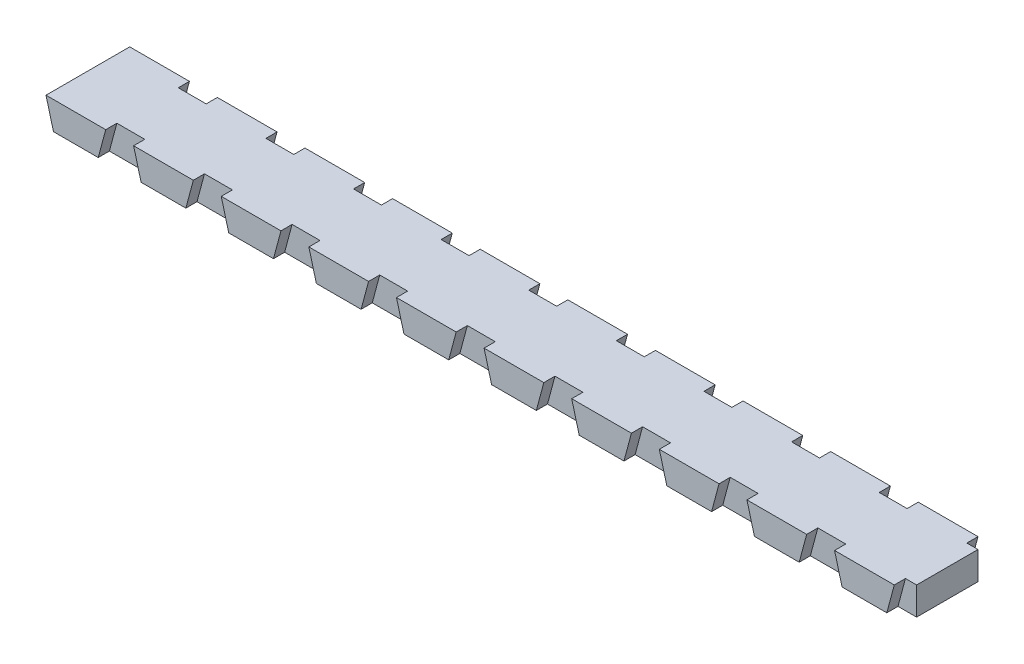
from build123d import *

# Parameters (mm, degrees)
SKETCH2_W            = 1540
SKETCH2_H            = 110
BOSS_EXTRUDE1_DEPTH  = 50
BOSS_EXTRUDE3_DEPTH  = 20
LPATTERN1_COUNT      = 10
LPATTERN1_PITCH      = 157
MIRROR2_COPY_1_DEPTH = 20
MIRROR2_COPY_2_DEPTH = 20
MIRROR2_COPY_3_DEPTH = 20
MIRROR2_COPY_4_DEPTH = 20
MIRROR2_COPY_5_DEPTH = 20
MIRROR2_COPY_6_DEPTH = 20
MIRROR2_COPY_7_DEPTH = 20
MIRROR2_COPY_8_DEPTH = 20
MIRROR2_COPY_9_DEPTH = 20


with BuildPart() as part:
    # Sketch2 → Boss-Extrude1 (new body)
    with BuildSketch(Plane(origin=(0, 0, 0), x_dir=(1, 0, 0), z_dir=(0, 1, 0))):
        Rectangle(SKETCH2_W, SKETCH2_H)
    extrude(amount=BOSS_EXTRUDE1_DEPTH)

    # Sketch4 → Boss-Extrude3 (add)
    with BuildSketch(Plane(origin=(0, 0, -55), x_dir=(-1, 0, 0), z_dir=(0, 0, -1))):
        Polygon((663, 50), (676.397459622, 0), (756.602540378, 0), (770, 50), align=None)
    boss_extrude3 = extrude(amount=BOSS_EXTRUDE3_DEPTH)

    # LPattern1: Boss-Extrude3 ×10
    with Locations(*[(i * LPATTERN1_PITCH, 0, 0) for i in range(1, LPATTERN1_COUNT)]):
        add(boss_extrude3)

    # Mirror2: Boss-Extrude3 across plane
    add(boss_extrude3.mirror(Plane(origin=(0, 0, 0), x_dir=(1, 0, 0), z_dir=(0, 0, -1))))

    # Mirror2 copy 1 sketch → Mirror2 copy 1 (add)
    with BuildSketch(Plane(origin=(157, 0, 55), x_dir=(-1, 0, 0), z_dir=(0, 0, 1))):
        Polygon((663, -50), (676.397459622, 0), (756.602540378, 0), (770, -50), align=None)
    extrude(amount=MIRROR2_COPY_1_DEPTH)

    # Mirror2 copy 2 sketch → Mirror2 copy 2 (add)
    with BuildSketch(Plane(origin=(314, 0, 55), x_dir=(-1, 0, 0), z_dir=(0, 0, 1))):
        Polygon((663, -50), (676.397459622, 0), (756.602540378, 0), (770, -50), align=None)
    extrude(amount=MIRROR2_COPY_2_DEPTH)

    # Mirror2 copy 3 sketch → Mirror2 copy 3 (add)
    with BuildSketch(Plane(origin=(471, 0, 55), x_dir=(-1, 0, 0), z_dir=(0, 0, 1))):
        Polygon((663, -50), (676.397459622, 0), (756.602540378, 0), (770, -50), align=None)
    extrude(amount=MIRROR2_COPY_3_DEPTH)

    # Mirror2 copy 4 sketch → Mirror2 copy 4 (add)
    with BuildSketch(Plane(origin=(628, 0, 55), x_dir=(-1, 0, 0), z_dir=(0, 0, 1))):
        Polygon((663, -50), (676.397459622, 0), (756.602540378, 0), (770, -50), align=None)
    extrude(amount=MIRROR2_COPY_4_DEPTH)

    # Mirror2 copy 5 sketch → Mirror2 copy 5 (add)
    with BuildSketch(Plane(origin=(785, 0, 55), x_dir=(-1, 0, 0), z_dir=(0, 0, 1))):
        Polygon((663, -50), (676.397459622, 0), (756.602540378, 0), (770, -50), align=None)
    extrude(amount=MIRROR2_COPY_5_DEPTH)

    # Mirror2 copy 6 sketch → Mirror2 copy 6 (add)
    with BuildSketch(Plane(origin=(942, 0, 55), x_dir=(-1, 0, 0), z_dir=(0, 0, 1))):
        Polygon((663, -50), (676.397459622, 0), (756.602540378, 0), (770, -50), align=None)
    extrude(amount=MIRROR2_COPY_6_DEPTH)

    # Mirror2 copy 7 sketch → Mirror2 copy 7 (add)
    with BuildSketch(Plane(origin=(1099, 0, 55), x_dir=(-1, 0, 0), z_dir=(0, 0, 1))):
        Polygon((663, -50), (676.397459622, 0), (756.602540378, 0), (770, -50), align=None)
    extrude(amount=MIRROR2_COPY_7_DEPTH)

    # Mirror2 copy 8 sketch → Mirror2 copy 8 (add)
    with BuildSketch(Plane(origin=(1256, 0, 55), x_dir=(-1, 0, 0), z_dir=(0, 0, 1))):
        Polygon((663, -50), (676.397459622, 0), (756.602540378, 0), (770, -50), align=None)
    extrude(amount=MIRROR2_COPY_8_DEPTH)

    # Mirror2 copy 9 sketch → Mirror2 copy 9 (add)
    with BuildSketch(Plane(origin=(1413, 0, 55), x_dir=(-1, 0, 0), z_dir=(0, 0, 1))):
        Polygon((663, -50), (676.397459622, 0), (756.602540378, 0), (770, -50), align=None)
    extrude(amount=MIRROR2_COPY_9_DEPTH)


solid = part.part
